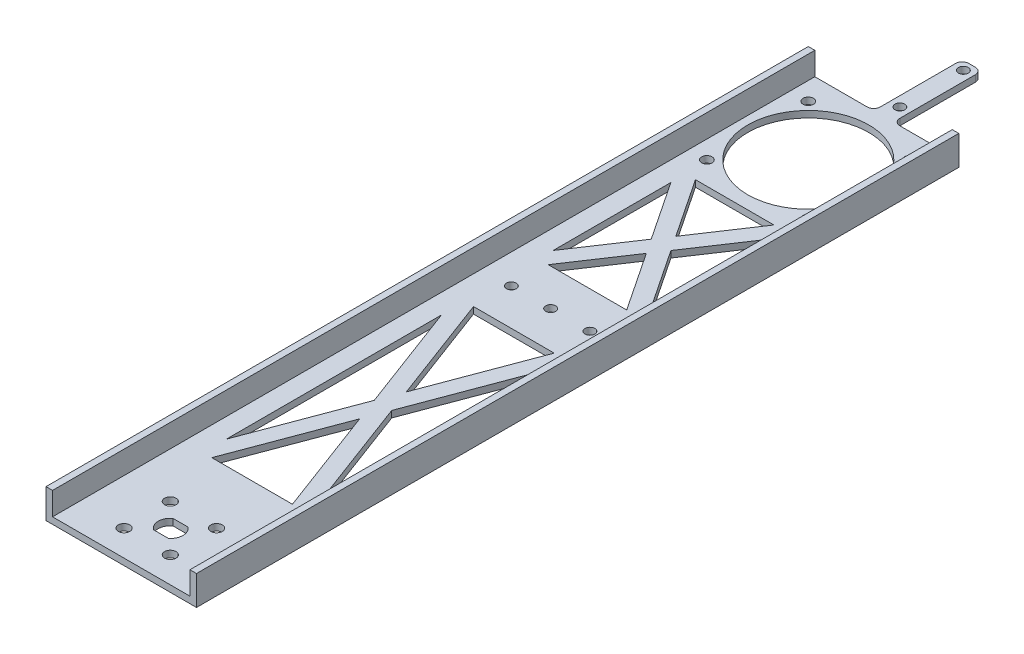
from build123d import *

# Parameters (mm, degrees)
SKETCH_2_W           = 42
SKETCH_2_H           = 46
SKETCH_2_R           = 18.5
EXTRUDE_1_DEPTH      = 2
SKETCH_3_R           = 1.6
CUT_EXTRUDE_1_DEPTH  = 32.208973069
SKETCH_4_W           = 42
SKETCH_4_H           = 187
EXTRUDE_2_DEPTH      = 2
SKETCH_7_W           = 6
SKETCH_7_H           = 27.05
SKETCH_7_R           = 1.5
EXTRUDE_4_DEPTH      = 2
FILLET_3_R           = 2
SKETCH_5_R           = 1.75
CUT_EXTRUDE_2_DEPTH  = 212.056864375
SKETCH_9_W           = 30
SKETCH_9_H           = 80
SKETCH_9_H_2         = 45
CUT_EXTRUDE_4_DEPTH  = 212.056864375
EXTRUDE_5_DEPTH      = 2
EXTRUDE_6_DEPTH      = 2
EXTRUDE_7_DEPTH      = 7
EXTRUDE_7_DEPTH_BACK = 2
SKETCH_13_W          = 2
SKETCH_13_H          = 233
SKETCH_15_R          = 1.5
CUT_EXTRUDE_5_DEPTH  = 212.371710501


with BuildPart() as part:
    # 草图2 → 凸台-拉伸1 (new body)
    with BuildSketch(Plane(origin=(0, 0, 0), x_dir=(1, 0, 0), z_dir=(0, 1, 0))):
        Rectangle(SKETCH_2_W, SKETCH_2_H)
        Circle(SKETCH_2_R, mode=Mode.SUBTRACT)
    extrude(amount=EXTRUDE_1_DEPTH)

    # 草图3 → 切除-拉伸1 (cut, through all)
    with BuildSketch(Plane(origin=(0, 2, 0), x_dir=(1, 0, 0), z_dir=(0, 1, 0))):
        with Locations((-15.5, 15.5)):
            Circle(SKETCH_3_R)
        with Locations((15.5, 15.5)):
            Circle(SKETCH_3_R)
        with Locations((-15.5, -15.5)):
            Circle(SKETCH_3_R)
        with Locations((15.5, -15.5)):
            Circle(SKETCH_3_R)
    extrude(amount=-CUT_EXTRUDE_1_DEPTH, mode=Mode.SUBTRACT)

    # 草图4 → 凸台-拉伸2 (add)
    with BuildSketch(Plane(origin=(0, 2, 0), x_dir=(1, 0, 0), z_dir=(0, 1, 0))):
        with Locations((0, -116.5)):
            Rectangle(SKETCH_4_W, SKETCH_4_H)
    extrude(amount=-EXTRUDE_2_DEPTH)

    # 草图7 → 凸台-拉伸4 (add)
    with BuildSketch(Plane(origin=(0, 2, 0), x_dir=(1, 0, 0), z_dir=(0, 1, 0))):
        with Locations((0, 36.525)):
            Rectangle(SKETCH_7_W, SKETCH_7_H)
        with Locations((0, 47.4)):
            Circle(SKETCH_7_R, mode=Mode.SUBTRACT)
        with Locations((0, 28)):
            Circle(SKETCH_7_R, mode=Mode.SUBTRACT)
    extrude(amount=-EXTRUDE_4_DEPTH)

    # 圆角3
    fillet_3_edges = [part.edges().sort_by_distance(p)[0] for p in [
        (3, 1, -23),
        (3, 1, -50.05),
        (-3, 1, -23),
        (-3, 1, -50.05),
    ]]
    fillet(fillet_3_edges, radius=FILLET_3_R)

    # 草图5 → 切除-拉伸2 (cut, through all)
    with BuildSketch(Plane(origin=(0, 2, 0), x_dir=(1, 0, 0), z_dir=(0, 1, 0))):
        with Locations((-7.071067812, -202.071067812)):
            Circle(SKETCH_5_R)
        with Locations((7.071067812, -202.071067812)):
            Circle(SKETCH_5_R)
        with Locations((-7.071067812, -187.928932188)):
            Circle(SKETCH_5_R)
        with Locations((7.071067812, -187.928932188)):
            Circle(SKETCH_5_R)
        with BuildLine():
            Line((-2.156670728, -192), (2.438064686, -192))
            ThreePointArc((2.438064686, -192), (3.865767636, -195), (2.438064686, -198))
            Line((2.438064686, -198), (-2.156670728, -198))
            ThreePointArc((-2.156670728, -198), (-3.694756911, -195), (-2.156670728, -192))
        make_face()
    extrude(amount=-CUT_EXTRUDE_2_DEPTH, mode=Mode.SUBTRACT)

    # 草图9 → 切除-拉伸4 (cut, through all)
    with BuildSketch(Plane(origin=(0, 2, 0), x_dir=(1, 0, 0), z_dir=(0, 1, 0))):
        with Locations((0, -130)):
            Rectangle(SKETCH_9_W, SKETCH_9_H)
        with Locations((0, -45)):
            Rectangle(SKETCH_9_W, SKETCH_9_H_2)
    extrude(amount=-CUT_EXTRUDE_4_DEPTH, mode=Mode.SUBTRACT)

    # 草图10 → 凸台-拉伸5 (add)
    with BuildSketch(Plane(origin=(0, 2, 0), x_dir=(1, 0, 0), z_dir=(0, 1, 0))):
        Polygon((12.919874264, -68.886750491), (-17.080125736, -23.886750491), (-12.919874264, -21.113249509), (17.080125736, -66.113249509), align=None)
        Polygon((12.659177056, -170.877808604), (-17.340822944, -90.877808604), (-12.659177056, -89.122191396), (17.340822944, -169.122191396), align=None)
    extrude(amount=-EXTRUDE_5_DEPTH)

    # 草图11 → 凸台-拉伸6 (add)
    with BuildSketch(Plane(origin=(0, 2, 0), x_dir=(1, 0, 0), z_dir=(0, 1, 0))):
        Polygon((-17.080125736, -66.113249509), (12.919874264, -21.113249509), (17.080125736, -23.886750491), (-12.919874264, -68.886750491), align=None)
        Polygon((-12.659177056, -170.877808604), (17.340822944, -90.877808604), (12.659177056, -89.122191396), (-17.340822944, -169.122191396), align=None)
    extrude(amount=-EXTRUDE_6_DEPTH)

    # 草图13 → 凸台-拉伸7 (add, two sides: drawn at the far end of the back side and taken through both)
    with BuildSketch(Plane(origin=(0, 2, 0), x_dir=(1, 0, 0), z_dir=(0, 1, 0)).offset(-EXTRUDE_7_DEPTH_BACK)):
        with Locations((22, -93.5)):
            Rectangle(SKETCH_13_W, SKETCH_13_H)
        with Locations((-22, -93.5)):
            Rectangle(SKETCH_13_W, SKETCH_13_H)
    extrude(amount=EXTRUDE_7_DEPTH + EXTRUDE_7_DEPTH_BACK)

    # 草图15 → 切除-拉伸5 (cut, through all)
    with BuildSketch(Plane(origin=(0, 2, 0), x_dir=(1, 0, 0), z_dir=(0, 1, 0))):
        with Locations((0, -78.75)):
            Circle(SKETCH_15_R)
        with Locations((-12, -78.75)):
            Circle(SKETCH_15_R)
        with Locations((12, -78.75)):
            Circle(SKETCH_15_R)
    extrude(amount=-CUT_EXTRUDE_5_DEPTH, mode=Mode.SUBTRACT)


solid = part.part
